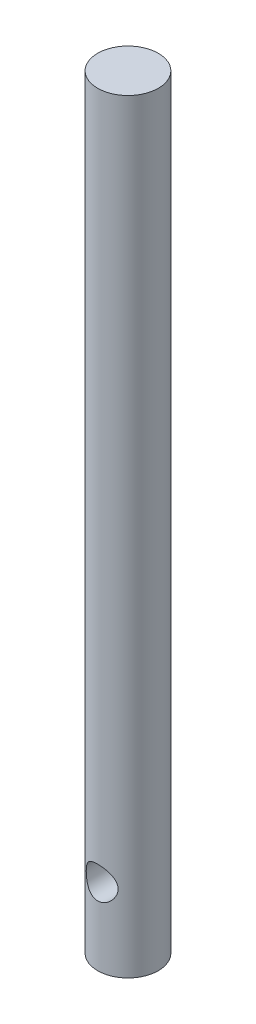
from build123d import *

# Parameters (mm, degrees)
SKETCH1_R           = 4.7625
BOSS_EXTRUDE1_DEPTH = 120
SKETCH2_R           = 2.5
CUT_EXTRUDE1_DEPTH  = 15


with BuildPart() as part:
    # Sketch1 → Boss-Extrude1 (new body)
    with BuildSketch(Plane(origin=(0, 0, 0), x_dir=(1, 0, 0), z_dir=(0, 1, 0))):
        Circle(SKETCH1_R)
    extrude(amount=BOSS_EXTRUDE1_DEPTH)

    # Sketch2 → Cut-Extrude1 (cut, symmetric)
    with BuildSketch(Plane.XY):
        with Locations((0, 12)):
            Circle(SKETCH2_R)
    extrude(amount=CUT_EXTRUDE1_DEPTH, both=True, mode=Mode.SUBTRACT)


solid = part.part
